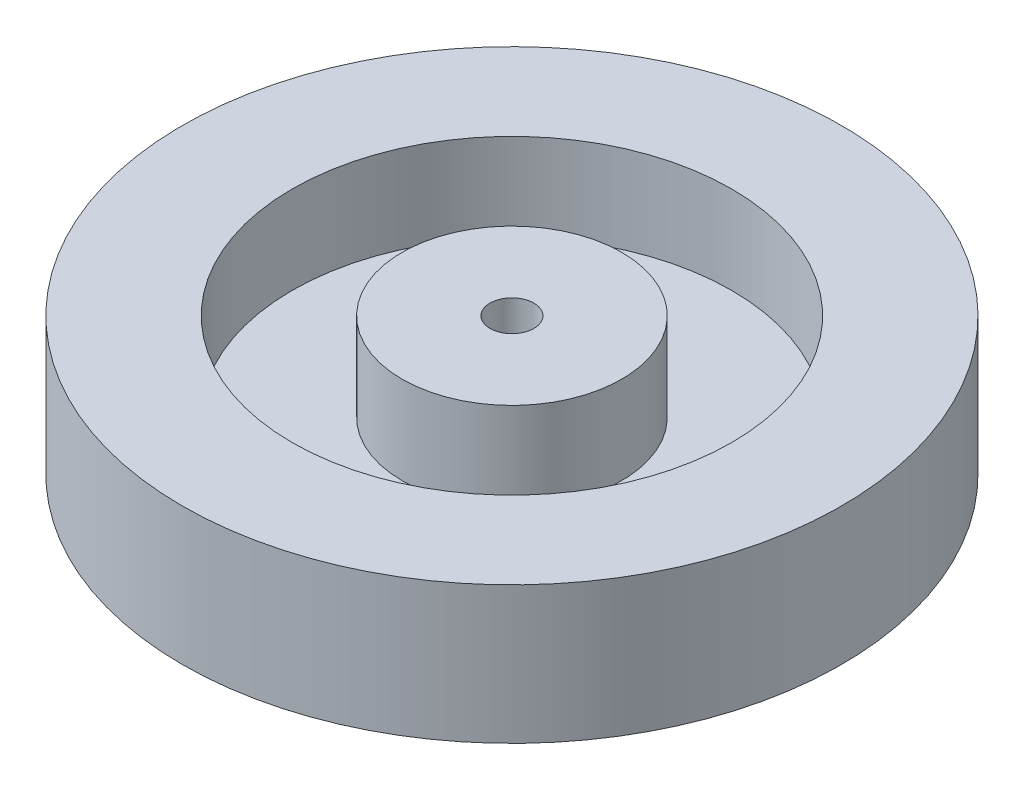
from build123d import *

# Parameters (mm, degrees)
SKETCH1_R           = 60
BOSS_EXTRUDE1_DEPTH = 25
SKETCH2_R           = 40
SKETCH2_R_2         = 20
CUT_EXTRUDE1_DEPTH  = 16
SKETCH3_R           = 20
BOSS_EXTRUDE2_DEPTH = 16
SKETCH4_R           = 4
CUT_EXTRUDE2_DEPTH  = 41


with BuildPart() as part:
    # Sketch1 → Boss-Extrude1 (new body)
    with BuildSketch(Plane(origin=(0, 0, 0), x_dir=(1, 0, 0), z_dir=(0, 1, 0))):
        with Locations(Location((0, 0, 0), (0, 0, 270))):
            Circle(SKETCH1_R)
    extrude(amount=BOSS_EXTRUDE1_DEPTH)

    # Sketch2 → Cut-Extrude1 (cut)
    with BuildSketch(Plane(origin=(0, 25, 0), x_dir=(1, 0, 0), z_dir=(0, 1, 0))):
        with Locations(Location((0, 0, 0), (0, 0, 270))):
            Circle(SKETCH2_R)
        with Locations(Location((0, 0, 0), (0, 0, 270))):
            Circle(SKETCH2_R_2, mode=Mode.SUBTRACT)
    extrude(amount=-CUT_EXTRUDE1_DEPTH, mode=Mode.SUBTRACT)

    # Sketch3 → Boss-Extrude2 (add)
    with BuildSketch(Plane.XZ):
        with Locations(Location((0, 0, 0), (0, 0, 90))):
            Circle(SKETCH3_R)
    extrude(amount=BOSS_EXTRUDE2_DEPTH)

    # Sketch4 → Cut-Extrude2 (cut)
    with BuildSketch(Plane.XZ.offset(16)):
        with Locations(Location((0, 0, 0), (0, 0, 270))):
            Circle(SKETCH4_R)
    extrude(amount=-CUT_EXTRUDE2_DEPTH, mode=Mode.SUBTRACT)


solid = part.part
